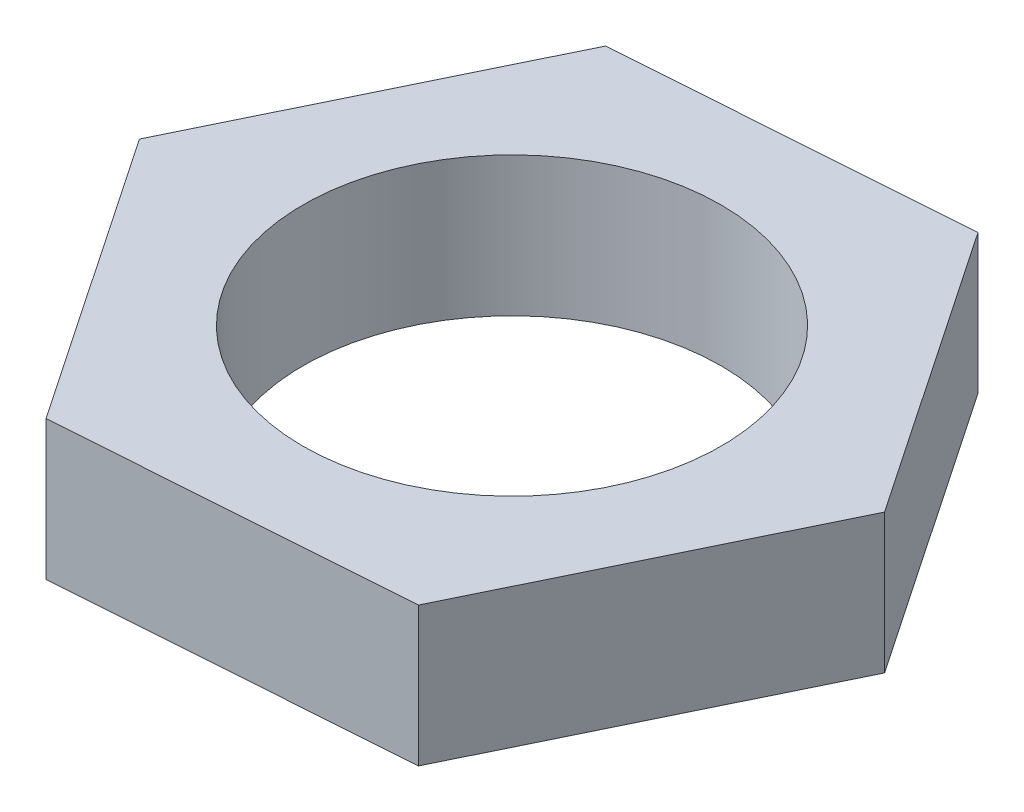
from build123d import *

# Parameters (mm, degrees)
SKETCH_1_R      = 4.5
EXTRUDE_1_DEPTH = 3


with BuildPart() as part:
    # 草图1 → 凸台-拉伸1 (new body)
    with BuildSketch(Plane(origin=(0, 0, 0), x_dir=(1, 0, 0), z_dir=(0, 1, 0))):
        Polygon((4.205066196, -6.216972867), (7.486589535, 0.533207717), (3.281523339, 6.750180583), (-4.205066196, 6.216972867), (-7.486589535, -0.533207717), (-3.281523339, -6.750180583), align=None)
        with Locations(Location((0, 0, 0), (0, 0, 270))):
            Circle(SKETCH_1_R, mode=Mode.SUBTRACT)
    extrude(amount=EXTRUDE_1_DEPTH)


solid = part.part
